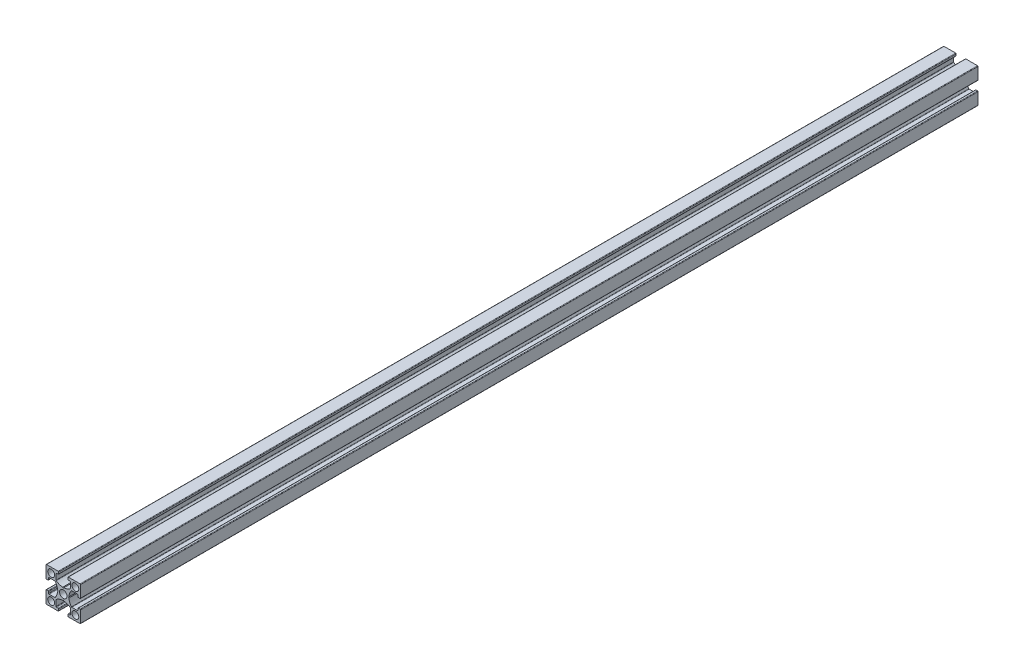
from build123d import *

# Parameters (mm, degrees)
MODEL_R         = 2.15
MODEL_R_2       = 2
EXTRUDE_1_DEPTH = 520


with BuildPart() as part:
    # Model → 보스-돌출1 (new body)
    with BuildSketch(Plane.XY):
        with BuildLine():
            Line((2307.763927197, 1192.134297913), (2307.763927197, 1195.391548465))
            ThreePointArc((2307.763927197, 1195.391548465), (2307.676059232, 1195.603680499), (2307.463927197, 1195.691548465))
            Line((2307.463927197, 1195.691548465), (2306.563927197, 1195.691548465))
            ThreePointArc((2306.563927197, 1195.691548465), (2306.351795163, 1195.779416431), (2306.263927197, 1195.991548465))
            Line((2306.263927197, 1195.991548465), (2306.263927197, 1196.891548465))
            ThreePointArc((2306.263927197, 1196.891548465), (2306.351795163, 1197.103680499), (2306.563927197, 1197.191548465))
            Line((2306.563927197, 1197.191548465), (2313.313927197, 1197.191548465))
            ThreePointArc((2313.313927197, 1197.191548465), (2313.526059232, 1197.103680499), (2313.613927197, 1196.891548465))
            Line((2313.613927197, 1196.891548465), (2313.613927197, 1190.141548465))
            ThreePointArc((2313.613927197, 1190.141548465), (2313.526059232, 1189.929416431), (2313.313927197, 1189.841548465))
            Line((2313.313927197, 1189.841548465), (2312.413927197, 1189.841548465))
            ThreePointArc((2312.413927197, 1189.841548465), (2312.201795163, 1189.929416431), (2312.113927197, 1190.141548465))
            Line((2312.113927197, 1190.141548465), (2312.113927197, 1191.041548465))
            ThreePointArc((2312.113927197, 1191.041548465), (2312.026059232, 1191.253680499), (2311.813927197, 1191.341548465))
            Line((2311.813927197, 1191.341548465), (2308.556676645, 1191.341548465))
            ThreePointArc((2308.556676645, 1191.341548465), (2308.426234796, 1191.311705686), (2308.321744595, 1191.228114625))
            ThreePointArc((2308.321744595, 1191.228114625), (2307.328306374, 1189.47356999), (2306.921204563, 1187.498825831))
            Line((2306.921204563, 1187.498825831), (2306.613927197, 1187.191548465))
            Line((2306.613927197, 1187.191548465), (2306.921204563, 1186.884271099))
            ThreePointArc((2306.921204563, 1186.884271099), (2307.328306374, 1184.90952694), (2308.321744595, 1183.154982305))
            ThreePointArc((2308.321744595, 1183.154982305), (2308.426234796, 1183.071391244), (2308.556676645, 1183.041548465))
            Line((2308.556676645, 1183.041548465), (2311.813927197, 1183.041548465))
            ThreePointArc((2311.813927197, 1183.041548465), (2312.026059232, 1183.129416431), (2312.113927197, 1183.341548465))
            Line((2312.113927197, 1183.341548465), (2312.113927197, 1184.241548465))
            ThreePointArc((2312.113927197, 1184.241548465), (2312.201795163, 1184.453680499), (2312.413927197, 1184.541548465))
            Line((2312.413927197, 1184.541548465), (2313.313927197, 1184.541548465))
            ThreePointArc((2313.313927197, 1184.541548465), (2313.526059232, 1184.453680499), (2313.613927197, 1184.241548465))
            Line((2313.613927197, 1184.241548465), (2313.613927197, 1177.491548465))
            ThreePointArc((2313.613927197, 1177.491548465), (2313.526059232, 1177.279416431), (2313.313927197, 1177.191548465))
            Line((2313.313927197, 1177.191548465), (2306.563927197, 1177.191548465))
            ThreePointArc((2306.563927197, 1177.191548465), (2306.351795163, 1177.279416431), (2306.263927197, 1177.491548465))
            Line((2306.263927197, 1177.491548465), (2306.263927197, 1178.391548465))
            ThreePointArc((2306.263927197, 1178.391548465), (2306.351795163, 1178.603680499), (2306.563927197, 1178.691548465))
            Line((2306.563927197, 1178.691548465), (2307.463927197, 1178.691548465))
            ThreePointArc((2307.463927197, 1178.691548465), (2307.676059232, 1178.779416431), (2307.763927197, 1178.991548465))
            Line((2307.763927197, 1178.991548465), (2307.763927197, 1182.248799017))
            ThreePointArc((2307.763927197, 1182.248799017), (2307.734084418, 1182.379240866), (2307.650493357, 1182.483731067))
            ThreePointArc((2307.650493357, 1182.483731067), (2305.895948722, 1183.477169289), (2303.921204563, 1183.884271099))
            Line((2303.921204563, 1183.884271099), (2303.613927197, 1184.191548465))
            Line((2303.613927197, 1184.191548465), (2303.306649831, 1183.884271099))
            ThreePointArc((2303.306649831, 1183.884271099), (2301.331905673, 1183.477169289), (2299.577361038, 1182.483731067))
            ThreePointArc((2299.577361038, 1182.483731067), (2299.493769977, 1182.379240866), (2299.463927197, 1182.248799017))
            Line((2299.463927197, 1182.248799017), (2299.463927197, 1178.991548465))
            ThreePointArc((2299.463927197, 1178.991548465), (2299.551795163, 1178.779416431), (2299.763927197, 1178.691548465))
            Line((2299.763927197, 1178.691548465), (2300.663927197, 1178.691548465))
            ThreePointArc((2300.663927197, 1178.691548465), (2300.876059232, 1178.603680499), (2300.963927197, 1178.391548465))
            Line((2300.963927197, 1178.391548465), (2300.963927197, 1177.491548465))
            ThreePointArc((2300.963927197, 1177.491548465), (2300.876059232, 1177.279416431), (2300.663927197, 1177.191548465))
            Line((2300.663927197, 1177.191548465), (2293.913927197, 1177.191548465))
            ThreePointArc((2293.913927197, 1177.191548465), (2293.701795163, 1177.279416431), (2293.613927197, 1177.491548465))
            Line((2293.613927197, 1177.491548465), (2293.613927197, 1184.241548465))
            ThreePointArc((2293.613927197, 1184.241548465), (2293.701795163, 1184.453680499), (2293.913927197, 1184.541548465))
            Line((2293.913927197, 1184.541548465), (2294.813927197, 1184.541548465))
            ThreePointArc((2294.813927197, 1184.541548465), (2295.026059232, 1184.453680499), (2295.113927197, 1184.241548465))
            Line((2295.113927197, 1184.241548465), (2295.113927197, 1183.341548465))
            ThreePointArc((2295.113927197, 1183.341548465), (2295.201795163, 1183.129416431), (2295.413927197, 1183.041548465))
            Line((2295.413927197, 1183.041548465), (2298.671177749, 1183.041548465))
            ThreePointArc((2298.671177749, 1183.041548465), (2298.801619599, 1183.071391244), (2298.906109799, 1183.154982305))
            ThreePointArc((2298.906109799, 1183.154982305), (2299.899548021, 1184.90952694), (2300.306649831, 1186.884271099))
            Line((2300.306649831, 1186.884271099), (2300.613927197, 1187.191548465))
            Line((2300.613927197, 1187.191548465), (2300.306649831, 1187.498825831))
            ThreePointArc((2300.306649831, 1187.498825831), (2299.899548021, 1189.47356999), (2298.906109799, 1191.228114625))
            ThreePointArc((2298.906109799, 1191.228114625), (2298.801619599, 1191.311705686), (2298.671177749, 1191.341548465))
            Line((2298.671177749, 1191.341548465), (2295.413927197, 1191.341548465))
            ThreePointArc((2295.413927197, 1191.341548465), (2295.201795163, 1191.253680499), (2295.113927197, 1191.041548465))
            Line((2295.113927197, 1191.041548465), (2295.113927197, 1190.141548465))
            ThreePointArc((2295.113927197, 1190.141548465), (2295.026059232, 1189.929416431), (2294.813927197, 1189.841548465))
            Line((2294.813927197, 1189.841548465), (2293.913927197, 1189.841548465))
            ThreePointArc((2293.913927197, 1189.841548465), (2293.701795163, 1189.929416431), (2293.613927197, 1190.141548465))
            Line((2293.613927197, 1190.141548465), (2293.613927197, 1196.891548465))
            ThreePointArc((2293.613927197, 1196.891548465), (2293.701795163, 1197.103680499), (2293.913927197, 1197.191548465))
            Line((2293.913927197, 1197.191548465), (2300.663927197, 1197.191548465))
            ThreePointArc((2300.663927197, 1197.191548465), (2300.876059232, 1197.103680499), (2300.963927197, 1196.891548465))
            Line((2300.963927197, 1196.891548465), (2300.963927197, 1195.991548465))
            ThreePointArc((2300.963927197, 1195.991548465), (2300.876059232, 1195.779416431), (2300.663927197, 1195.691548465))
            Line((2300.663927197, 1195.691548465), (2299.763927197, 1195.691548465))
            ThreePointArc((2299.763927197, 1195.691548465), (2299.551795163, 1195.603680499), (2299.463927197, 1195.391548465))
            Line((2299.463927197, 1195.391548465), (2299.463927197, 1192.134297913))
            ThreePointArc((2299.463927197, 1192.134297913), (2299.493769977, 1192.003856063), (2299.577361038, 1191.899365863))
            ThreePointArc((2299.577361038, 1191.899365863), (2301.331905673, 1190.905927641), (2303.306649831, 1190.498825831))
            Line((2303.306649831, 1190.498825831), (2303.613927197, 1190.191548465))
            Line((2303.613927197, 1190.191548465), (2303.921204563, 1190.498825831))
            ThreePointArc((2303.921204563, 1190.498825831), (2305.895948722, 1190.905927641), (2307.650493357, 1191.899365863))
            ThreePointArc((2307.650493357, 1191.899365863), (2307.734084418, 1192.003856063), (2307.763927197, 1192.134297913))
        make_face()
        with Locations((2303.613927197, 1187.191548465)):
            Circle(MODEL_R, mode=Mode.SUBTRACT)
        with Locations((2296.613927197, 1194.191548465)):
            Circle(MODEL_R_2, mode=Mode.SUBTRACT)
        with Locations((2296.613927197, 1180.191548465)):
            Circle(MODEL_R_2, mode=Mode.SUBTRACT)
        with Locations((2310.613927197, 1194.191548465)):
            Circle(MODEL_R_2, mode=Mode.SUBTRACT)
        with Locations((2310.613927197, 1180.191548465)):
            Circle(MODEL_R_2, mode=Mode.SUBTRACT)
    extrude(amount=EXTRUDE_1_DEPTH)


solid = part.part
